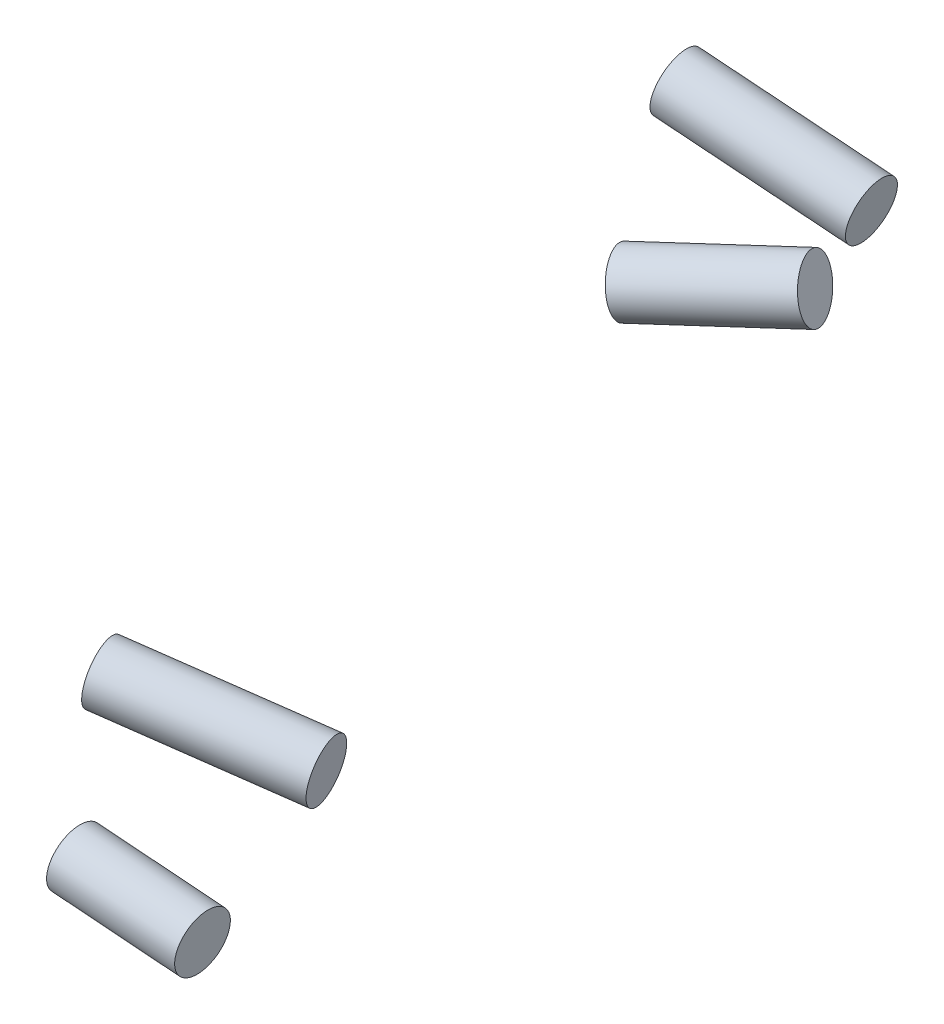
from build123d import *

# Parameters (mm, degrees)
SUSP_FR_ROCKER_BRACKET_A_PROFILE_R   = 7
SUSP_FR_ROCKER_BRACKET_B_PROFILE_R   = 7
SUSP_FR_COILOVER_BRACKET_A_PROFILE_R = 7
SUSP_FR_COILOVER_BRACKET_B_PROFILE_R = 7


with BuildPart() as part:
    # SUSP_FR_rocker_bracket_a: sweep along a curve in space
    with BuildLine() as susp_fr_rocker_bracket_a_path:
        Line((258.30426, 43.4708888, -246.608444), (300.152615, 37.6935056, -258.791888))
    # SUSP_FR_rocker_bracket_a profile (on start of the path) → SUSP_FR_rocker_bracket_a (sweep)
    with BuildSketch(Plane(origin=(258.30426, 43.4708888, -246.608444), x_dir=(0.2795278895031742, 0, 0.9601375729497837), z_dir=(0.951812297367076, -0.13140264118773481, -0.27710412568147824))):
        Circle(SUSP_FR_ROCKER_BRACKET_A_PROFILE_R)
    sweep(path=susp_fr_rocker_bracket_a_path.line)


with BuildPart() as body_2:
    # SUSP_FR_rocker_bracket_b: sweep along a curve in space
    with BuildLine() as susp_fr_rocker_bracket_b_path:
        Line((253.16093, 3.06062272, -245.112504), (282.547385, -0.733505554, -246.568112))
    # SUSP_FR_rocker_bracket_b profile (on start of the path) → SUSP_FR_rocker_bracket_b (sweep)
    with BuildSketch(Plane(origin=(253.16093, 3.06062272, -245.112504), x_dir=(0.12804860626096684, 0.9917678934280055, 0), z_dir=(0.990573329465155, -0.12789437435696369, -0.04906636281770392))):
        Circle(SUSP_FR_ROCKER_BRACKET_B_PROFILE_R)
    sweep(path=susp_fr_rocker_bracket_b_path.line)


with BuildPart() as body_3:
    # SUSP_FR_coilover_bracket_a: sweep along a curve in space
    with BuildLine() as susp_fr_coilover_bracket_a_path:
        Line((164.805861, 4.04738961, -478.324842), (206.559789, -4.69578838, -483.635731))
    # SUSP_FR_coilover_bracket_a profile (on start of the path) → SUSP_FR_coilover_bracket_a (sweep)
    with BuildSketch(Plane(origin=(164.805861, 4.04738961, -478.324842), x_dir=(0.2049526189830252, 0.9787718957816468, 0), z_dir=(0.9712739650393727, -0.20338256926132248, -0.1235411484379151))):
        Circle(SUSP_FR_COILOVER_BRACKET_A_PROFILE_R)
    sweep(path=susp_fr_coilover_bracket_a_path.line)


with BuildPart() as body_4:
    # SUSP_FR_coilover_bracket_b: sweep along a curve in space
    with BuildLine() as susp_fr_coilover_bracket_b_path:
        Line((166.026177, -30.2321009, -464.318765), (198.557411, -22.1626116, -478.079469))
    # SUSP_FR_coilover_bracket_b profile (on start of the path) → SUSP_FR_coilover_bracket_b (sweep)
    with BuildSketch(Plane(origin=(166.026177, -30.2321009, -464.318765), x_dir=(0.3895797084653776, 0, 0.9209927528227524), z_dir=(0.8978602133296604, 0.22271744700368298, -0.37979464993569667))):
        Circle(SUSP_FR_COILOVER_BRACKET_B_PROFILE_R)
    sweep(path=susp_fr_coilover_bracket_b_path.line)


solid = Compound([part.part, body_2.part, body_3.part, body_4.part])
